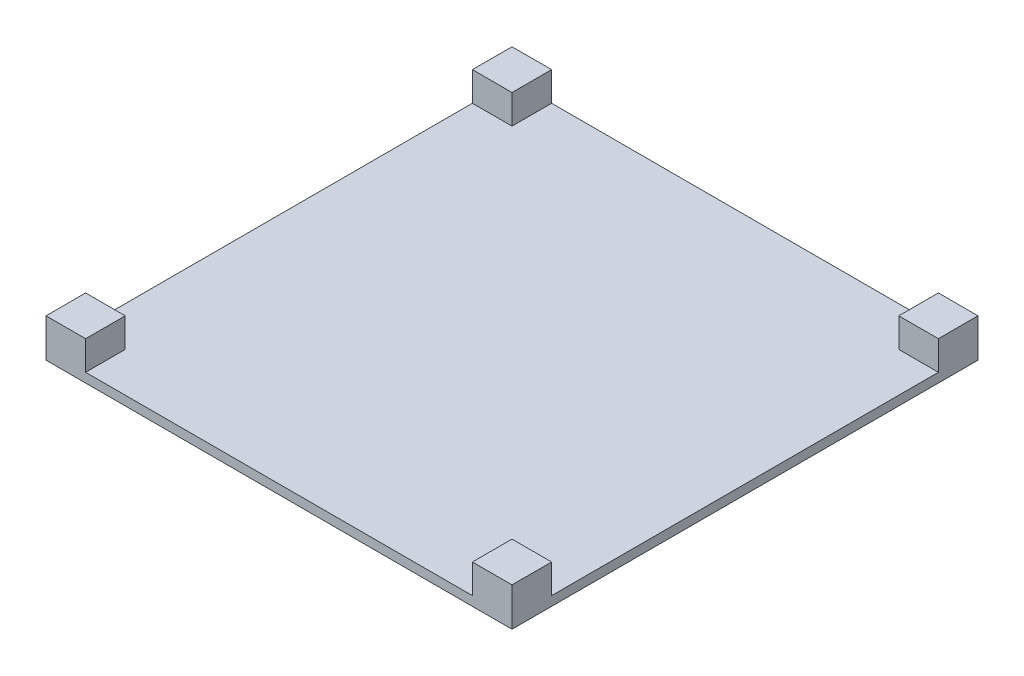
from build123d import *

# Parameters (mm, degrees)
SKETCH1_W           = 100
SKETCH1_H           = 100
BOSS_EXTRUDE2_DEPTH = 2
SKETCH3_W           = 8.5
SKETCH3_H           = 8.5
BOSS_EXTRUDE4_DEPTH = 6.25


with BuildPart() as part:
    # Sketch1 → Boss-Extrude2 (new body)
    with BuildSketch(Plane(origin=(0, 0, 0), x_dir=(1, 0, 0), z_dir=(0, 1, 0))):
        Rectangle(SKETCH1_W, SKETCH1_H)
    extrude(amount=BOSS_EXTRUDE2_DEPTH)

    # Sketch3 → Boss-Extrude4 (add)
    with BuildSketch(Plane(origin=(0, 2, 0), x_dir=(1, 0, 0), z_dir=(0, 1, 0))):
        with Locations((45.75, -45.75)):
            Rectangle(SKETCH3_W, SKETCH3_H)
        with Locations((-45.75, -45.75)):
            Rectangle(SKETCH3_W, SKETCH3_H)
        with Locations((45.75, 45.75)):
            Rectangle(SKETCH3_W, SKETCH3_H)
        with Locations((-45.75, 45.75)):
            Rectangle(SKETCH3_W, SKETCH3_H)
    extrude(amount=BOSS_EXTRUDE4_DEPTH)


solid = part.part
